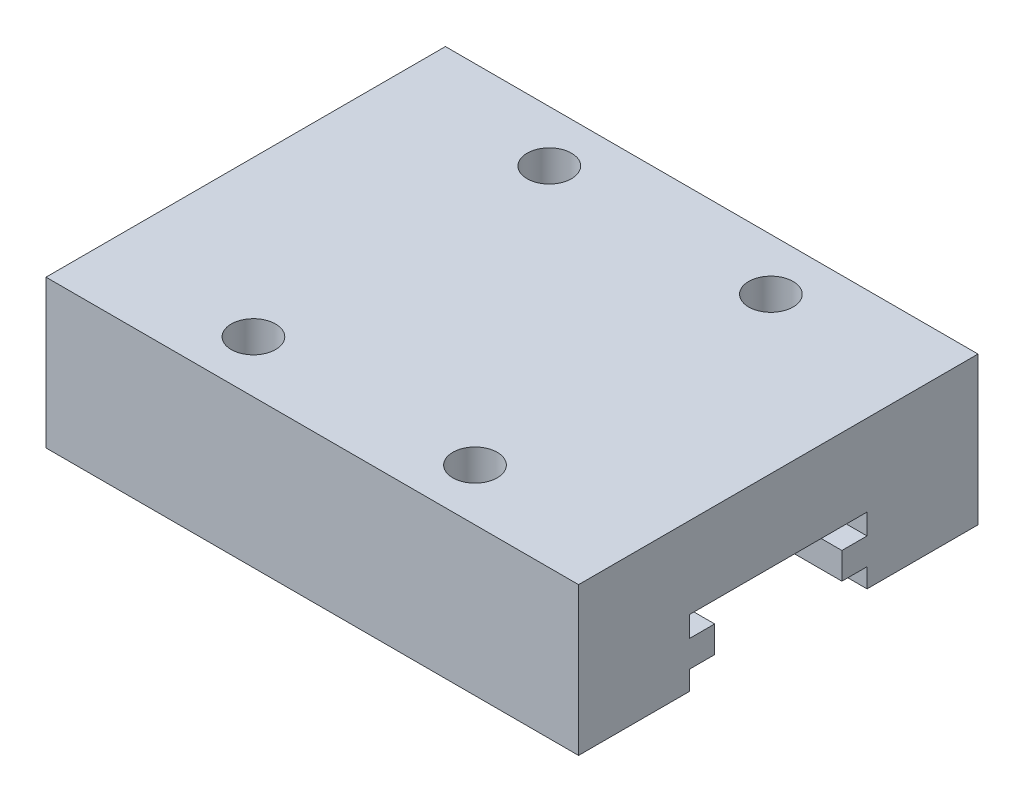
from build123d import *

# Parameters (mm, degrees)
CROQUIS1_W              = 36
CROQUIS1_H              = 27
SALIENTE_EXTRUIR1_DEPTH = 10
CROQUIS2_R              = 1.5
CORTAR_EXTRUIR1_DEPTH   = 5
CORTAR_EXTRUIR2_DEPTH   = 36


with BuildPart() as part:
    # Croquis1 → Saliente-Extruir1 (new body)
    with BuildSketch(Plane(origin=(0, 0, 0), x_dir=(1, 0, 0), z_dir=(0, 1, 0))):
        with Locations((18, 13.5)):
            Rectangle(CROQUIS1_W, CROQUIS1_H)
    extrude(amount=SALIENTE_EXTRUIR1_DEPTH)

    # Croquis2 → Cortar-Extruir1 (cut)
    with BuildSketch(Plane(origin=(0, 10, 0), x_dir=(1, 0, 0), z_dir=(0, 1, 0))):
        with Locations(Location((10.5, 23.52014925, 0), (0, 0, 270))):
            Circle(CROQUIS2_R)
        with Locations(Location((25.499986467, 23.5, 0), (0, 0, 270))):
            Circle(CROQUIS2_R)
        with Locations(Location((10.5, 3.52014925, 0), (0, 0, 270))):
            Circle(CROQUIS2_R)
        with Locations(Location((25.499986467, 3.5, 0), (0, 0, 270))):
            Circle(CROQUIS2_R)
    extrude(amount=-CORTAR_EXTRUIR1_DEPTH, mode=Mode.SUBTRACT)

    # Croquis3 → Cortar-Extruir2 (cut)
    with BuildSketch(Plane(origin=(36, 0, 0), x_dir=(0, 0, -1), z_dir=(1, 0, 0))):
        Polygon((7.5, 0), (19.5, 0), (19.5, 1.3), (17.8, 1.3), (17.8, 3.1), (19.5, 3.1), (19.5, 4.5), (7.5, 4.5), (7.5, 3.1), (9.2, 3.1), (9.2, 1.3), (7.5, 1.3), align=None)
    extrude(amount=-CORTAR_EXTRUIR2_DEPTH, mode=Mode.SUBTRACT)


solid = part.part
